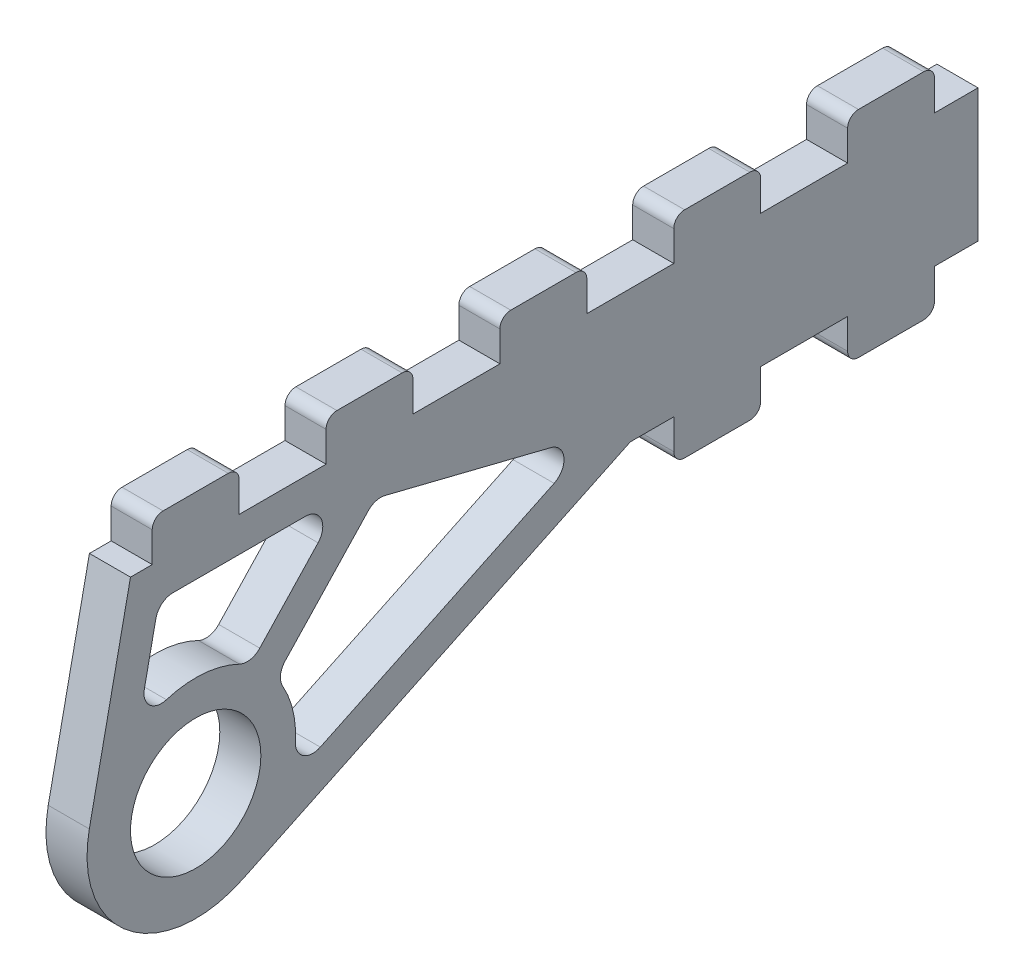
from build123d import *

# Parameters (mm, degrees)
SKETCH1_R              = 9.525
BOSS_EXTRUDE1_DEPTH    = 3
CUT_EXTRUDE1_DEPTH     = 72.404901793
SKETCH4_W              = 50.8
SKETCH4_H              = 19.4
BOSS_EXTRUDE3_DEPTH    = 6
SKETCH3_W              = 6
SKETCH3_H              = 12.7
BOSS_EXTRUDE2_DEPTH    = 6
FILLET1_R              = 1.5875
LPATTERN1_COUNT        = 5
LPATTERN1_PITCH        = 25.4
FILLET1_OF_LPATTERN1_R = 1.5875
SKETCH5_W              = 12.7
SKETCH5_H              = 6
BOSS_EXTRUDE4_DEPTH    = 6
FILLET2_R              = 1.5875
LPATTERN2_COUNT        = 2
LPATTERN2_PITCH        = 25.4
FILLET2_OF_LPATTERN2_R = 1.5875
CUT_EXTRUDE2_DEPTH     = 121.632085284
FILLET3_R              = 2.54


with BuildPart() as part:
    # Sketch1 → Boss-Extrude1 (new, symmetric)
    with BuildSketch(Plane(origin=(0, 0, 0), x_dir=(0, 0, -1), z_dir=(1, 0, 0))):
        with BuildLine():
            Line((-15.540953853, 3.23950279), (-9.525, 32.1))
            Line((-9.525, 32.1), (63.5, 32.1))
            Line((63.5, 32.1), (63.5, -15.875))
            Line((63.5, -15.875), (0, -15.875))
            ThreePointArc((0, -15.875), (-12.317522717, -10.014702148), (-15.540953853, 3.23950279))
        make_face()
        Circle(SKETCH1_R, mode=Mode.SUBTRACT)
    extrude(amount=BOSS_EXTRUDE1_DEPTH, both=True)

    # Sketch2 → Cut-Extrude1 (cut, through all)
    with BuildSketch(Plane(origin=(3, 0, 0), x_dir=(0, 0, -1), z_dir=(1, 0, 0))):
        with BuildLine():
            Line((6.834450038, -14.328500189), (63.5, 12.7))
            Line((63.5, 12.7), (63.5, -15.875))
            Line((63.5, -15.875), (0, -15.875))
            ThreePointArc((0, -15.875), (3.50361845, -15.483548778), (6.834450038, -14.328500189))
        make_face()
    extrude(amount=-CUT_EXTRUDE1_DEPTH, mode=Mode.SUBTRACT)

    # Sketch4 → Boss-Extrude3 (add)
    with BuildSketch(Plane(origin=(3, 0, 0), x_dir=(0, 0, -1), z_dir=(1, 0, 0))):
        with Locations((88.9, 22.4)):
            Rectangle(SKETCH4_W, SKETCH4_H)
    extrude(amount=-BOSS_EXTRUDE3_DEPTH)

    # Sketch3 → Boss-Extrude2 (add)
    with BuildSketch(Plane(origin=(0, 32.1, 0), x_dir=(1, 0, 0), z_dir=(0, 1, 0))):
        Rectangle(SKETCH3_W, SKETCH3_H)
    boss_extrude2 = extrude(amount=BOSS_EXTRUDE2_DEPTH)

    # Fillet1
    fillet1_edges = [part.edges().sort_by_distance(p)[0] for p in [
        (0, 38.1, -6.35),
        (0, 38.1, 6.35),
    ]]
    fillet(fillet1_edges, radius=FILLET1_R)

    # LPattern1: Boss-Extrude2 ×5
    with Locations(*[(0, 0, -i * LPATTERN1_PITCH) for i in range(1, LPATTERN1_COUNT)]):
        add(boss_extrude2)

    # Fillet1 of LPattern1
    fillet1_of_lpattern1_edges = [part.edges().sort_by_distance(p)[0] for p in [
        (0, 38.1, -31.75),
        (0, 38.1, -19.05),
        (0, 38.1, -57.15),
        (0, 38.1, -44.45),
        (0, 38.1, -82.55),
        (0, 38.1, -69.85),
        (0, 38.1, -107.95),
        (0, 38.1, -95.25),
    ]]
    fillet(fillet1_of_lpattern1_edges, radius=FILLET1_OF_LPATTERN1_R)

    # Sketch5 → Boss-Extrude4 (add)
    with BuildSketch(Plane.ZY.offset(3)):
        with Locations((-76.2, 9.7)):
            Rectangle(SKETCH5_W, SKETCH5_H)
    boss_extrude4 = extrude(amount=-BOSS_EXTRUDE4_DEPTH)

    # Fillet2
    fillet2_edges = [part.edges().sort_by_distance(p)[0] for p in [
        (0, 6.7, -82.55),
        (0, 6.7, -69.85),
    ]]
    fillet(fillet2_edges, radius=FILLET2_R)

    # LPattern2: Boss-Extrude4 ×2
    with Locations(*[(0, 0, -i * LPATTERN2_PITCH) for i in range(1, LPATTERN2_COUNT)]):
        add(boss_extrude4)

    # Fillet2 of LPattern2
    fillet2_of_lpattern2_edges = [part.edges().sort_by_distance(p)[0] for p in [
        (0, 6.7, -107.95),
        (0, 6.7, -95.25),
    ]]
    fillet(fillet2_of_lpattern2_edges, radius=FILLET2_OF_LPATTERN2_R)

    # Sketch6 → Cut-Extrude2 (cut, through all)
    with BuildSketch(Plane(origin=(3, 0, 0), x_dir=(0, 0, -1), z_dir=(1, 0, 0))):
        with BuildLine():
            Line((-1.27, 27.02), (-5.394730621, 27.02))
            Line((-5.394730621, 27.02), (-8.560402164, 11.83323877))
            ThreePointArc((-8.560402164, 11.83323877), (-0.341722831, 14.601001695), (7.997440758, 12.220759646))
            Line((7.997440758, 12.220759646), (21.902982951, 27.02))
            Line((21.902982951, 27.02), (1.27, 27.02))
            Line((1.27, 27.02), (-1.27, 27.02))
        make_face()
        with BuildLine():
            ThreePointArc((14.605, 0), (14.332832255, -2.806411331), (13.526472843, -5.50822634))
            Line((13.526472843, -5.50822634), (58.749014948, 16.062154405))
            Line((58.749014948, 16.062154405), (26.218568583, 24.19428546))
            Line((26.218568583, 24.19428546), (11.699586285, 8.742179692))
            ThreePointArc((11.699586285, 8.742179692), (13.859626306, 4.606168001), (14.605, 0))
        make_face()
    extrude(amount=-CUT_EXTRUDE2_DEPTH, mode=Mode.SUBTRACT)

    # Fillet3
    fillet3_edges = [part.edges().sort_by_distance(p)[0] for p in [
        (0, -5.50822634, -13.526472843),
        (0, 8.742179692, -11.699586285),
        (0, 24.19428546, -26.218568583),
        (0, 16.062154405, -58.749014948),
        (0, 12.220759646, -7.997440758),
        (0, 11.83323877, 8.560402164),
        (0, 27.02, 5.394730621),
        (0, 27.02, -21.902982951),
    ]]
    fillet(fillet3_edges, radius=FILLET3_R)


solid = part.part
